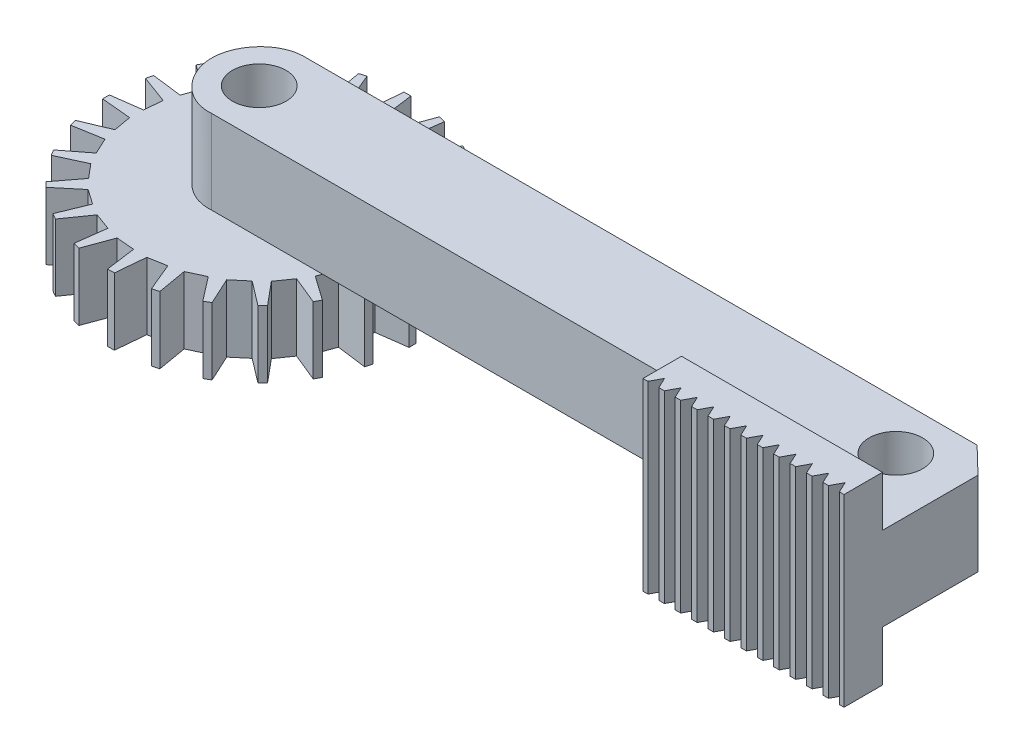
from build123d import *

# Parameters (mm, degrees)
ESQUISSE1_R                  = 9
BOSS_EXTRU_1_DEPTH           = 4
BOSS_EXTRU_2_DEPTH           = 5
ENL_V_MAT_EXTRU_1_DEPTH      = 4
ENL_V_MAT_EXTRU_2_DEPTH      = 3
ENL_V_MAT_EXTRU_2_DEPTH_BACK = 12
ESQUISSE4_R                  = 1.6
BOSS_EXTRU_3_DEPTH           = 3
BOSS_EXTRU_3_DEPTH_BACK      = 8
ESQUISSE5_W                  = 12
ESQUISSE5_H                  = 2.3
ENL_V_MAT_EXTRU_3_DEPTH      = 11
ESQUISSE7_R                  = 1.6
ENL_V_MAT_EXTRU_4_DEPTH      = 11


with BuildPart() as part:
    # Esquisse1 → Boss.-Extru.1 (new body)
    with BuildSketch(Plane(origin=(0, 0, 0), x_dir=(1, 0, 0), z_dir=(0, 1, 0))):
        with Locations(Location((0, 0, 0), (0, 0, 270))):
            Circle(ESQUISSE1_R)
    extrude(amount=BOSS_EXTRU_1_DEPTH)

    # Esquisse2 → Boss.-Extru.2 (add)
    with BuildSketch(Plane(origin=(0, 4, 0), x_dir=(1, 0, 0), z_dir=(0, 1, 0))):
        with BuildLine():
            Line((0, 2.85), (28, 2.85))
            Line((28, 2.85), (40, 2.85))
            Line((40, 2.85), (41.582547561, 1.321751585))
            Line((41.582547561, 1.321751585), (41.582547561, -6.678248415))
            Line((41.582547561, -6.678248415), (29.582547561, -6.678248415))
            Line((29.582547561, -6.678248415), (29.582547561, -4.378248415))
            Line((29.582547561, -4.378248415), (28, -2.85))
            Line((28, -2.85), (0, -2.85))
            add(Edge.make_bspline(
                [(0, 2.85), (-1.583763235, 2.944784931), (-4.146375178, 0.014422281), (-1.543874763, -2.966253476), (0, -2.85)],
                knots=[0, 0, 0, 0, 0.500311959, 1, 1, 1, 1], degree=3))
        make_face()
    extrude(amount=BOSS_EXTRU_2_DEPTH)

    # Esquisse3 → Enlèv. mat.-Extru.1 (cut)
    with BuildSketch(Plane.XZ):
        Polygon((0.351449311, 8.993135348), (0.513444021, 7.221842901), (1.577304258, 7.034102859), (2.276601179, 8.707300791), (1.416805586, 9.582955874), align=None)
        Polygon((3.344118704, 6.386185235), (4.452643151, 7.821378969), (3.848780595, 8.889728302), (2.667068669, 8.595739917), (2.365099324, 6.84287548), align=None)
        Polygon((4.883036987, 5.30305964), (6.325244851, 6.402443094), (6.018467567, 7.590680437), (4.800931705, 7.612559016), (4.055577016, 5.997577404), align=None)
        Polygon((6.089184369, 3.858539294), (7.766791567, 4.547191304), (7.77800592, 5.774340245), (6.607619179, 6.110594798), (5.469673837, 4.743554339), align=None)
        Polygon((6.880363898, 2.151065872), (8.679044273, 2.382055941), (9.007486024, 3.564488307), (7.964008326, 4.192203643), (6.511021425, 3.166265885), align=None)
        Polygon((7.202657999, 0.297000866), (8.999834455, 0.054587401), (9.62312084, 1.111722382), (8.777663467, 1.988120738), (7.108653663, 1.373201643), align=None)
        Polygon((7.034102859, -1.577304258), (8.707300791, -2.276601179), (9.582955874, -1.416805586), (8.993135348, -0.351449311), (7.221842901, -0.513444021), align=None)
        Polygon((6.386185235, -3.344118704), (7.821378969, -4.452643151), (8.889728302, -3.848780595), (8.595739917, -2.667068669), (6.84287548, -2.365099324), align=None)
        Polygon((5.30305964, -4.883036987), (6.402443094, -6.325244851), (7.590680437, -6.018467567), (7.612559016, -4.800931705), (5.997577404, -4.055577016), align=None)
        Polygon((3.858539294, -6.089184369), (4.547191304, -7.766791567), (5.774340245, -7.77800592), (6.110594798, -6.607619179), (4.743554339, -5.469673837), align=None)
        Polygon((2.151065872, -6.880363898), (2.382055941, -8.679044273), (3.564488307, -9.007486024), (4.192203643, -7.964008326), (3.166265885, -6.511021425), align=None)
        Polygon((0.297000866, -7.202657999), (0.054587401, -8.999834455), (1.111722382, -9.62312084), (1.988120738, -8.777663467), (1.373201643, -7.108653663), align=None)
        Polygon((-1.577304258, -7.034102859), (-2.276601179, -8.707300791), (-1.416805586, -9.582955874), (-0.351449311, -8.993135348), (-0.513444021, -7.221842901), align=None)
        Polygon((-3.344118704, -6.386185235), (-4.452643151, -7.821378969), (-3.848780595, -8.889728302), (-2.667068669, -8.595739917), (-2.365099324, -6.84287548), align=None)
        Polygon((-4.883036987, -5.30305964), (-6.325244851, -6.402443094), (-6.018467567, -7.590680437), (-4.800931705, -7.612559016), (-4.055577016, -5.997577404), align=None)
        Polygon((-6.089184369, -3.858539294), (-7.766791567, -4.547191304), (-7.77800592, -5.774340245), (-6.607619179, -6.110594798), (-5.469673837, -4.743554339), align=None)
        Polygon((-6.880363898, -2.151065872), (-8.679044273, -2.382055941), (-9.007486024, -3.564488307), (-7.964008326, -4.192203643), (-6.511021425, -3.166265885), align=None)
        Polygon((-7.202657999, -0.297000866), (-8.999834455, -0.054587401), (-9.62312084, -1.111722382), (-8.777663467, -1.988120738), (-7.108653663, -1.373201643), align=None)
        Polygon((-7.034102859, 1.577304258), (-8.707300791, 2.276601179), (-9.582955874, 1.416805586), (-8.993135348, 0.351449311), (-7.221842901, 0.513444021), align=None)
        Polygon((-6.386185235, 3.344118704), (-7.821378969, 4.452643151), (-8.889728302, 3.848780595), (-8.595739917, 2.667068669), (-6.84287548, 2.365099324), align=None)
        Polygon((-5.30305964, 4.883036987), (-6.402443094, 6.325244851), (-7.590680437, 6.018467567), (-7.612559016, 4.800931705), (-5.997577404, 4.055577016), align=None)
        Polygon((-3.858539294, 6.089184369), (-4.547191304, 7.766791567), (-5.774340245, 7.77800592), (-6.110594798, 6.607619179), (-4.743554339, 5.469673837), align=None)
        Polygon((-2.151065872, 6.880363898), (-2.382055941, 8.679044273), (-3.564488307, 9.007486024), (-4.192203643, 7.964008326), (-3.166265885, 6.511021425), align=None)
        Polygon((-0.297000866, 7.202657999), (-0.054587401, 8.999834455), (-1.111722382, 9.62312084), (-1.988120738, 8.777663467), (-1.373201643, 7.108653663), align=None)
    extrude(amount=-ENL_V_MAT_EXTRU_1_DEPTH, mode=Mode.SUBTRACT)

    # Esquisse4 → Enlèv. mat.-Extru.2 (cut, two sides: drawn at the far end of the back side and taken through both)
    with BuildSketch(Plane(origin=(0, 9, 0), x_dir=(1, 0, 0), z_dir=(0, 1, 0)).offset(-ENL_V_MAT_EXTRU_2_DEPTH_BACK)):
        with Locations(Location((0, 0, 0), (0, 0, 90))):
            Circle(ESQUISSE4_R)
    extrude(amount=ENL_V_MAT_EXTRU_2_DEPTH + ENL_V_MAT_EXTRU_2_DEPTH_BACK, mode=Mode.SUBTRACT)

    # Esquisse5 → Boss.-Extru.3 (add, two sides: drawn at the far end of the back side and taken through both)
    with BuildSketch(Plane(origin=(0, 9, 0), x_dir=(1, 0, 0), z_dir=(0, 1, 0)).offset(-BOSS_EXTRU_3_DEPTH_BACK)):
        with Locations((35.582547561, -5.528248415)):
            Rectangle(ESQUISSE5_W, ESQUISSE5_H)
    extrude(amount=BOSS_EXTRU_3_DEPTH + BOSS_EXTRU_3_DEPTH_BACK)

    # Esquisse6 → Enlèv. mat.-Extru.3 (cut)
    with BuildSketch(Plane(origin=(0, 12, 0), x_dir=(1, 0, 0), z_dir=(0, 1, 0))):
        Polygon((41.30726734, -6.678248415), (41.004659891, -6.028248415), (40.65726734, -6.678248415), (41.004659891, -7.030774788), align=None)
        Polygon((40.32726734, -6.678248415), (40.024659891, -6.028248415), (39.67726734, -6.678248415), (40.024659891, -7.030774788), align=None)
        Polygon((39.34726734, -6.678248415), (39.044659891, -6.028248415), (38.69726734, -6.678248415), (39.044659891, -7.030774788), align=None)
        Polygon((38.36726734, -6.678248415), (38.064659891, -6.028248415), (37.71726734, -6.678248415), (38.064659891, -7.030774788), align=None)
        Polygon((37.38726734, -6.678248415), (37.084659891, -6.028248415), (36.73726734, -6.678248415), (37.084659891, -7.030774788), align=None)
        Polygon((36.40726734, -6.678248415), (36.104659891, -6.028248415), (35.75726734, -6.678248415), (36.104659891, -7.030774788), align=None)
        Polygon((35.42726734, -6.678248415), (35.124659891, -6.028248415), (34.77726734, -6.678248415), (35.124659891, -7.030774788), align=None)
        Polygon((34.44726734, -6.678248415), (34.144659891, -6.028248415), (33.79726734, -6.678248415), (34.144659891, -7.030774788), align=None)
        Polygon((33.46726734, -6.678248415), (33.164659891, -6.028248415), (32.81726734, -6.678248415), (33.164659891, -7.030774788), align=None)
        Polygon((32.48726734, -6.678248415), (32.184659891, -6.028248415), (31.83726734, -6.678248415), (32.184659891, -7.030774788), align=None)
        Polygon((31.50726734, -6.678248415), (31.204659891, -6.028248415), (30.85726734, -6.678248415), (31.204659891, -7.030774788), align=None)
        Polygon((30.52726734, -6.678248415), (30.224659891, -6.028248415), (29.87726734, -6.678248415), (30.224659891, -7.030774788), align=None)
    extrude(amount=-ENL_V_MAT_EXTRU_3_DEPTH, mode=Mode.SUBTRACT)

    # Esquisse7 → Enlèv. mat.-Extru.4 (cut)
    with BuildSketch(Plane(origin=(0, 9, 0), x_dir=(1, 0, 0), z_dir=(0, 1, 0))):
        with Locations(Location((38, 0, 0), (0, 0, 270))):
            Circle(ESQUISSE7_R)
    extrude(amount=-ENL_V_MAT_EXTRU_4_DEPTH, mode=Mode.SUBTRACT)


solid = part.part
